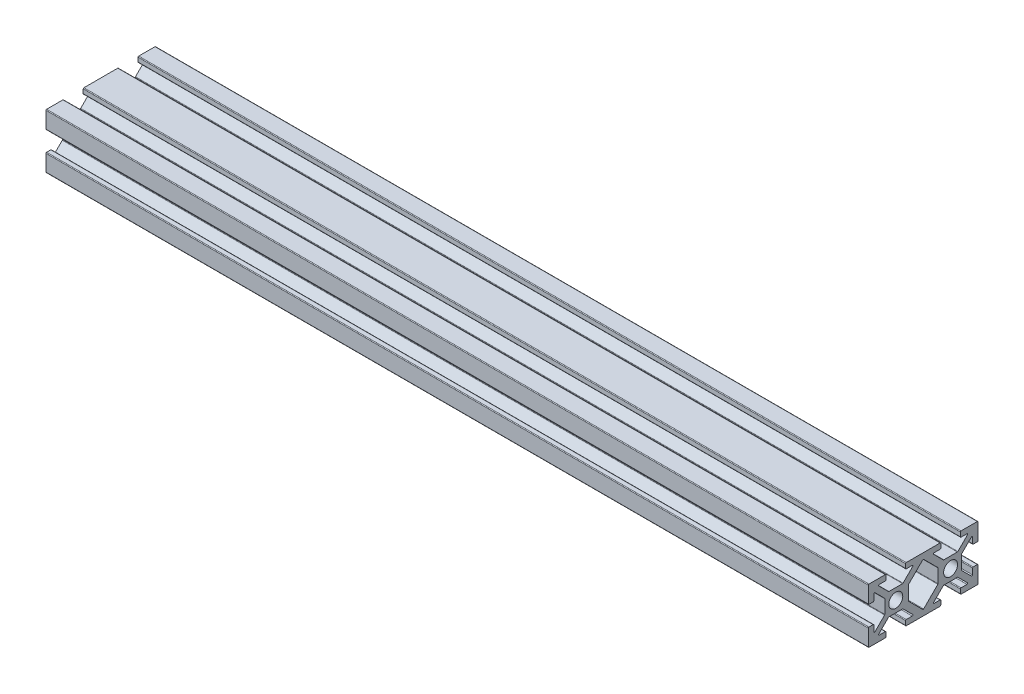
from build123d import *

# Parameters (mm, degrees)
SKETCH2_R           = 2.55
BOSS_EXTRUDE2_DEPTH = 300
FILLET1_R           = 0.25
FILLET2_R           = 0.25


with BuildPart() as part:
    # Sketch2 → Boss-Extrude2 (new body)
    with BuildSketch(Plane(origin=(0, 0, 0), x_dir=(0, 0, -1), z_dir=(1, 0, 0))):
        Polygon((-20, 13.585786438), (-20, 20), (-13.585786438, 20), (-13.585786438, 18), (-16.585786438, 18), (-12.58578916, 14), (-7.41421084, 14), (-3.414213562, 18), (-6.414213562, 18), (-6.414213562, 20), (0, 20), (0, 18), (-5.414207154, 12.58578916), (-5.414207154, 7.41421084), (0, 2), (0, 0), (-6.414213562, 0), (-6.414213562, 2), (-3.414213562, 2), (-7.41421084, 6), (-12.58578916, 6), (-16.585786438, 2), (-13.585786438, 2), (-13.585786438, 0), (-20, 0), (-20, 6.414213562), (-18, 6.414213562), (-18, 3.414213562), (-14.000005445, 7.41421084), (-14.000005445, 12.58578916), (-18, 16.585786438), (-18, 13.585786438), align=None)
        with Locations((-10, 10)):
            Circle(SKETCH2_R, mode=Mode.SUBTRACT)
    extrude(amount=BOSS_EXTRUDE2_DEPTH)

    # Fillet1
    fillet1_edges = [part.edges().sort_by_distance(p)[0] for p in [
        (150, 13.585786438, 20),
        (150, 20, 20),
        (150, 20, 13.585786438),
        (150, 18, 13.585786438),
        (150, 18, 16.585786438),
        (150, 14, 12.58578916),
        (150, 14, 7.41421084),
        (150, 18, 3.414213562),
        (150, 18, 6.414213562),
        (150, 20, 6.414213562),
        (150, 12.58578916, 5.414207154),
        (150, 7.41421084, 5.414207154),
        (150, 0, 6.414213562),
        (150, 2, 6.414213562),
        (150, 2, 3.414213562),
        (150, 6, 7.41421084),
        (150, 6, 12.58578916),
        (150, 2, 16.585786438),
        (150, 2, 13.585786438),
        (150, 0, 13.585786438),
        (150, 0, 20),
        (150, 6.414213562, 20),
        (150, 6.414213562, 18),
        (150, 3.414213562, 18),
        (150, 7.41421084, 14.000005445),
        (150, 12.58578916, 14.000005445),
        (150, 16.585786438, 18),
        (150, 13.585786438, 18),
    ]]
    fillet(fillet1_edges, radius=FILLET1_R)

    # Mirror3: part across plane


with BuildPart() as part_1:
    add(part.part)
    add(part.part.mirror(Plane(origin=(300, 20, 0), x_dir=(1, 0, 0), z_dir=(0, 0, 1))))

    # Fillet2
    fillet2_edges = [part_1.edges().sort_by_distance(p)[0] for p in [
        (150, 2, 0),
        (150, 18, 0),
    ]]
    fillet(fillet2_edges, radius=FILLET2_R)


solid = part_1.part
